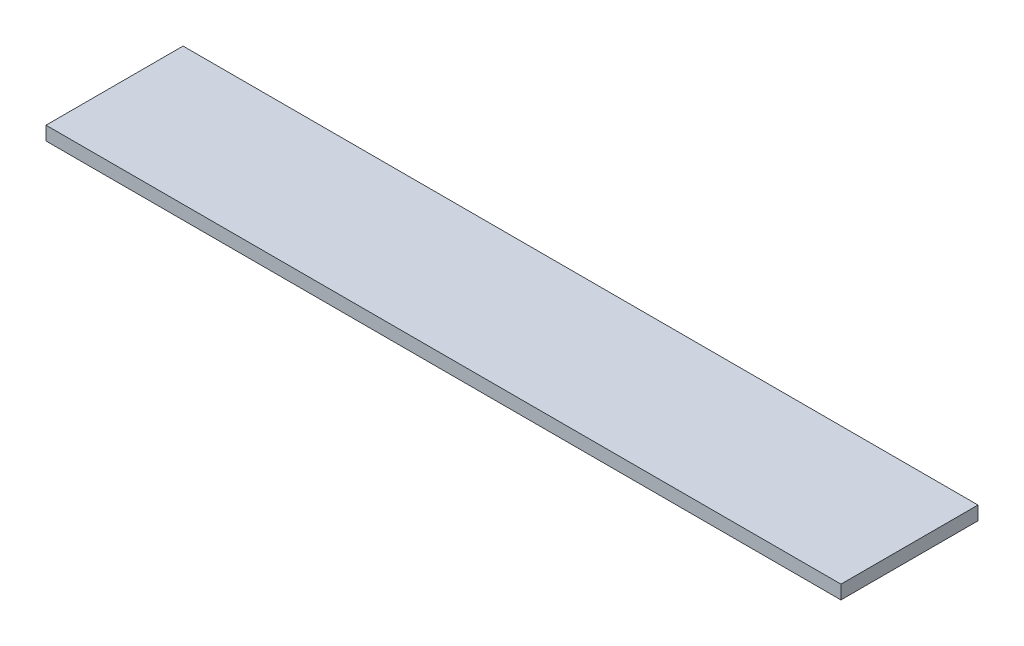
from build123d import *

# Parameters (mm, degrees)
BOSS_EXTRUDE1_DEPTH = 1.5875
CUT_EXTRUDE1_START  = -1.5875
SKETCH2_W           = 132.168329665
SKETCH2_H           = 39.637629539
SKETCH2_W_2         = 92.075
SKETCH2_H_2         = 15.875
CUT_EXTRUDE1_DEPTH  = 1.5875


with BuildPart() as part:
    # Sketch1 → Boss-Extrude1 (new body)
    with BuildSketch(Plane(origin=(0, 0, 0), x_dir=(1, 0, 0), z_dir=(0, 1, 0))):
        with BuildLine():
            Line((-47.625, 7.9375), (47.625, 7.9375))
            ThreePointArc((47.625, 7.9375), (55.5625, 0), (47.625, -7.9375))
            Line((47.625, -7.9375), (-47.625, -7.9375))
            ThreePointArc((-47.625, -7.9375), (-55.5625, 0), (-47.625, 7.9375))
        make_face()
    extrude(amount=BOSS_EXTRUDE1_DEPTH)

    # Sketch2 → Cut-Extrude1 (cut)
    with BuildSketch(Plane(origin=(0, 1.5875, 0), x_dir=(1, 0, 0), z_dir=(0, 1, 0)).offset(CUT_EXTRUDE1_START)):
        with Locations((-1.994750837, -0.57912121)):
            Rectangle(SKETCH2_W, SKETCH2_H)
        Rectangle(SKETCH2_W_2, SKETCH2_H_2, mode=Mode.SUBTRACT)
    extrude(amount=CUT_EXTRUDE1_DEPTH, mode=Mode.SUBTRACT)


solid = part.part
